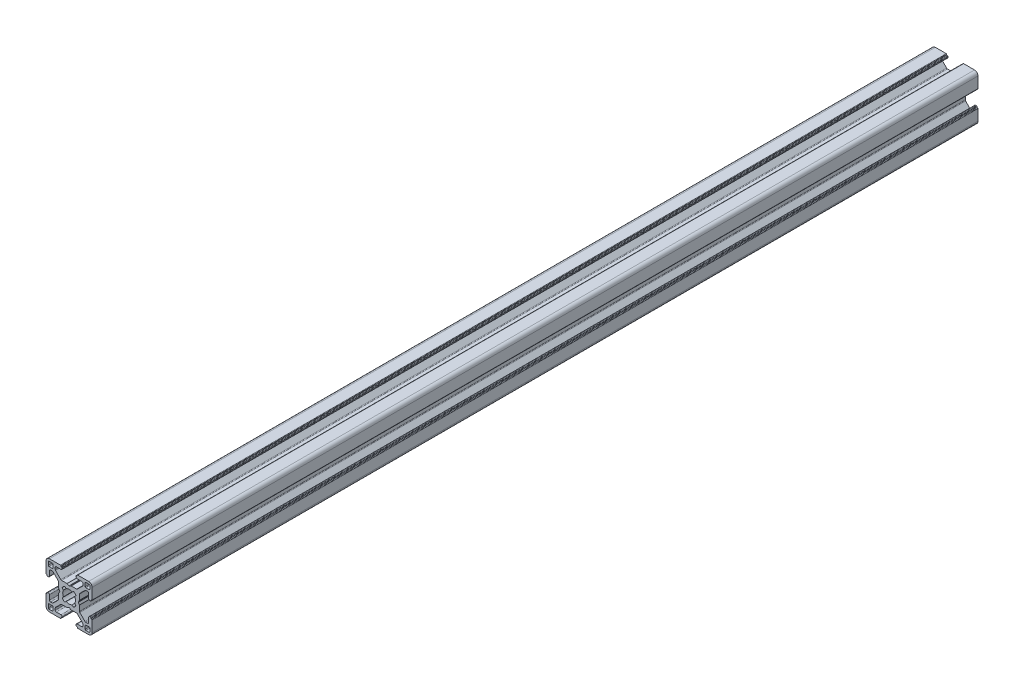
from build123d import *

# Parameters (mm, degrees)
ESTRUSIONE_ESTRUSIONE1_DEPTH = 384


with BuildPart() as part:
    # Schizzo1 → Estrusione-Estrusione1 (new body)
    with BuildSketch(Plane.XY.offset(100)):
        with BuildLine():
            Line((-9.299999732, 3), (-8.999999732, 3))
            ThreePointArc((-8.999999732, 3), (-8.646446341, 3.146446609), (-8.499999732, 3.5))
            Line((-8.499999732, 3.5), (-8.499999732, 5.499999605))
            ThreePointArc((-8.499999732, 5.499999605), (-8.353553123, 5.853552995), (-7.999999732, 5.999999605))
            Line((-7.999999732, 5.999999605), (-7.267766685, 5.999999605))
            ThreePointArc((-7.267766685, 5.999999605), (-7.076424969, 5.961939371), (-6.914213294, 5.853552995))
            Line((-6.914213294, 5.853552995), (-4.646446398, 3.585786099))
            ThreePointArc((-4.646446398, 3.585786099), (-4.538060023, 3.423574425), (-4.499999789, 3.232232708))
            Line((-4.499999789, 3.232232708), (-4.499999789, 0.953589302))
            ThreePointArc((-4.499999789, 0.953589302), (-4.493184953, 0.90182549), (-4.473204867, 0.853589297))
            Line((-4.473204867, 0.853589297), (-4.038119841, 0.099999969))
            ThreePointArc((-4.038119841, 0.099999969), (-4.011324929, 0), (-4.038119841, -0.099999969))
            Line((-4.038119841, -0.099999969), (-4.473204867, -0.853589297))
            ThreePointArc((-4.473204867, -0.853589297), (-4.493184953, -0.90182549), (-4.499999789, -0.953589302))
            Line((-4.499999789, -0.953589302), (-4.499999789, -3.232232708))
            ThreePointArc((-4.499999789, -3.232232708), (-4.538060023, -3.423574425), (-4.646446398, -3.585786099))
            Line((-4.646446398, -3.585786099), (-6.914213294, -5.853552995))
            ThreePointArc((-6.914213294, -5.853552995), (-7.076424969, -5.961939371), (-7.267766685, -5.999999605))
            Line((-7.267766685, -5.999999605), (-7.999999732, -5.999999605))
            ThreePointArc((-7.999999732, -5.999999605), (-8.353553123, -5.853552995), (-8.499999732, -5.499999605))
            Line((-8.499999732, -5.499999605), (-8.499999732, -3.5))
            ThreePointArc((-8.499999732, -3.5), (-8.646446341, -3.146446609), (-8.999999732, -3))
            Line((-8.999999732, -3), (-9.299999732, -3))
            ThreePointArc((-9.299999732, -3), (-9.441421088, -3.058578644), (-9.499999732, -3.2))
            Line((-9.499999732, -3.2), (-9.499999732, -3.349999605))
            ThreePointArc((-9.499999732, -3.349999605), (-9.558578376, -3.491420961), (-9.699999732, -3.549999605))
            Line((-9.699999732, -3.549999605), (-9.8, -3.549999605))
            ThreePointArc((-9.8, -3.549999605), (-9.941421356, -3.608578248), (-10, -3.749999605))
            Line((-10, -3.749999605), (-10, -8.5))
            ThreePointArc((-10, -8.5), (-9.560660172, -9.560660172), (-8.5, -10))
            Line((-8.5, -10), (-3.750000228, -10))
            ThreePointArc((-3.750000228, -10), (-3.608578871, -9.941421356), (-3.550000228, -9.8))
            Line((-3.550000228, -9.8), (-3.550000228, -9.7))
            ThreePointArc((-3.550000228, -9.7), (-3.491421584, -9.558578644), (-3.350000228, -9.5))
            Line((-3.350000228, -9.5), (-3.2, -9.5))
            ThreePointArc((-3.2, -9.5), (-3.058578644, -9.441421356), (-3, -9.3))
            Line((-3, -9.3), (-3, -8.999999673))
            ThreePointArc((-3, -8.999999673), (-3.146446609, -8.646446283), (-3.5, -8.499999673))
            Line((-3.5, -8.499999673), (-5.500000686, -8.499999673))
            ThreePointArc((-5.500000686, -8.499999673), (-5.853554077, -8.353553064), (-6.000000686, -7.999999673))
            Line((-6.000000686, -7.999999673), (-6.000000686, -7.267766626))
            ThreePointArc((-6.000000686, -7.267766626), (-5.961940448, -7.076424899), (-5.853554059, -6.914213219))
            Line((-5.853554059, -6.914213219), (-3.585787212, -4.646446592))
            ThreePointArc((-3.585787212, -4.646446592), (-3.423575544, -4.538060229), (-3.232233839, -4.5))
            Line((-3.232233839, -4.5), (-0.953590312, -4.5))
            ThreePointArc((-0.953590312, -4.5), (-0.901826505, -4.493185166), (-0.853590316, -4.473205083))
            Line((-0.853590316, -4.473205083), (-0.100000045, -4.038119562))
            ThreePointArc((-0.100000045, -4.038119562), (0, -4.011324632), (0.100000045, -4.038119562))
            Line((0.100000045, -4.038119562), (0.853590316, -4.473205083))
            ThreePointArc((0.853590316, -4.473205083), (0.901826505, -4.493185166), (0.953590312, -4.5))
            Line((0.953590312, -4.5), (3.23223292, -4.5))
            ThreePointArc((3.23223292, -4.5), (3.423574636, -4.538060234), (3.58578631, -4.646446609))
            Line((3.58578631, -4.646446609), (5.853554077, -6.914214376))
            ThreePointArc((5.853554077, -6.914214376), (5.961940452, -7.07642605), (6.000000686, -7.267767766))
            Line((6.000000686, -7.267767766), (6.000000686, -7.999999673))
            ThreePointArc((6.000000686, -7.999999673), (5.853554077, -8.353553064), (5.500000686, -8.499999673))
            Line((5.500000686, -8.499999673), (3.5, -8.499999673))
            ThreePointArc((3.5, -8.499999673), (3.146446609, -8.646446283), (3, -8.999999673))
            Line((3, -8.999999673), (3, -9.3))
            ThreePointArc((3, -9.3), (3.058578644, -9.441421356), (3.2, -9.5))
            Line((3.2, -9.5), (3.350000228, -9.5))
            ThreePointArc((3.350000228, -9.5), (3.491421584, -9.558578644), (3.550000228, -9.7))
            Line((3.550000228, -9.7), (3.550000228, -9.8))
            ThreePointArc((3.550000228, -9.8), (3.608578871, -9.941421356), (3.750000228, -10))
            Line((3.750000228, -10), (8.5, -10))
            ThreePointArc((8.5, -10), (9.560660172, -9.560660172), (10, -8.5))
            Line((10, -8.5), (10, -3.749999605))
            ThreePointArc((10, -3.749999605), (9.941421356, -3.608578248), (9.8, -3.549999605))
            Line((9.8, -3.549999605), (9.699999732, -3.549999605))
            ThreePointArc((9.699999732, -3.549999605), (9.558578376, -3.491420961), (9.499999732, -3.349999605))
            Line((9.499999732, -3.349999605), (9.499999732, -3.2))
            ThreePointArc((9.499999732, -3.2), (9.441421088, -3.058578644), (9.299999732, -3))
            Line((9.299999732, -3), (8.999999732, -3))
            ThreePointArc((8.999999732, -3), (8.646446341, -3.146446609), (8.499999732, -3.5))
            Line((8.499999732, -3.5), (8.499999732, -5.499999605))
            ThreePointArc((8.499999732, -5.499999605), (8.353553123, -5.853552995), (7.999999732, -5.999999605))
            Line((7.999999732, -5.999999605), (7.267766789, -5.999999605))
            ThreePointArc((7.267766789, -5.999999605), (7.076425084, -5.961939376), (6.914213416, -5.853553012))
            Line((6.914213416, -5.853553012), (4.646446415, -3.585786233))
            ThreePointArc((4.646446415, -3.585786233), (4.538060027, -3.423574553), (4.499999789, -3.232232825))
            Line((4.499999789, -3.232232825), (4.499999789, -0.953589302))
            ThreePointArc((4.499999789, -0.953589302), (4.493184953, -0.90182549), (4.473204867, -0.853589297))
            Line((4.473204867, -0.853589297), (4.038119841, -0.099999969))
            ThreePointArc((4.038119841, -0.099999969), (4.011324929, 0), (4.038119841, 0.099999969))
            Line((4.038119841, 0.099999969), (4.473204867, 0.853589297))
            ThreePointArc((4.473204867, 0.853589297), (4.493184953, 0.90182549), (4.499999789, 0.953589302))
            Line((4.499999789, 0.953589302), (4.499999789, 3.232232825))
            ThreePointArc((4.499999789, 3.232232825), (4.538060027, 3.423574553), (4.646446415, 3.585786233))
            Line((4.646446415, 3.585786233), (6.914213416, 5.853553012))
            ThreePointArc((6.914213416, 5.853553012), (7.076425084, 5.961939376), (7.267766789, 5.999999605))
            Line((7.267766789, 5.999999605), (7.999999732, 5.999999605))
            ThreePointArc((7.999999732, 5.999999605), (8.353553123, 5.853552995), (8.499999732, 5.499999605))
            Line((8.499999732, 5.499999605), (8.499999732, 3.5))
            ThreePointArc((8.499999732, 3.5), (8.646446341, 3.146446609), (8.999999732, 3))
            Line((8.999999732, 3), (9.299999732, 3))
            ThreePointArc((9.299999732, 3), (9.441421088, 3.058578644), (9.499999732, 3.2))
            Line((9.499999732, 3.2), (9.499999732, 3.349999605))
            ThreePointArc((9.499999732, 3.349999605), (9.558578376, 3.491420961), (9.699999732, 3.549999605))
            Line((9.699999732, 3.549999605), (9.8, 3.549999605))
            ThreePointArc((9.8, 3.549999605), (9.941421356, 3.608578248), (10, 3.749999605))
            Line((10, 3.749999605), (10, 8.5))
            ThreePointArc((10, 8.5), (9.560660172, 9.560660172), (8.5, 10))
            Line((8.5, 10), (3.750000228, 10))
            ThreePointArc((3.750000228, 10), (3.608578871, 9.941421356), (3.550000228, 9.8))
            Line((3.550000228, 9.8), (3.550000228, 9.7))
            ThreePointArc((3.550000228, 9.7), (3.491421584, 9.558578644), (3.350000228, 9.5))
            Line((3.350000228, 9.5), (3.2, 9.5))
            ThreePointArc((3.2, 9.5), (3.058578644, 9.441421356), (3, 9.3))
            Line((3, 9.3), (3, 8.999999673))
            ThreePointArc((3, 8.999999673), (3.146446609, 8.646446283), (3.5, 8.499999673))
            Line((3.5, 8.499999673), (5.500000686, 8.499999673))
            ThreePointArc((5.500000686, 8.499999673), (5.853554077, 8.353553064), (6.000000686, 7.999999673))
            Line((6.000000686, 7.999999673), (6.000000686, 7.267767766))
            ThreePointArc((6.000000686, 7.267767766), (5.961940452, 7.07642605), (5.853554077, 6.914214376))
            Line((5.853554077, 6.914214376), (3.58578631, 4.646446609))
            ThreePointArc((3.58578631, 4.646446609), (3.423574636, 4.538060234), (3.23223292, 4.5))
            Line((3.23223292, 4.5), (0.953590312, 4.5))
            ThreePointArc((0.953590312, 4.5), (0.901826505, 4.493185166), (0.853590316, 4.473205083))
            Line((0.853590316, 4.473205083), (0.100000045, 4.038119562))
            ThreePointArc((0.100000045, 4.038119562), (0, 4.011324632), (-0.100000045, 4.038119562))
            Line((-0.100000045, 4.038119562), (-0.853590316, 4.473205083))
            ThreePointArc((-0.853590316, 4.473205083), (-0.901826505, 4.493185166), (-0.953590312, 4.5))
            Line((-0.953590312, 4.5), (-3.232233839, 4.5))
            ThreePointArc((-3.232233839, 4.5), (-3.423575544, 4.538060229), (-3.585787212, 4.646446592))
            Line((-3.585787212, 4.646446592), (-5.853554059, 6.914213219))
            ThreePointArc((-5.853554059, 6.914213219), (-5.961940448, 7.076424899), (-6.000000686, 7.267766626))
            Line((-6.000000686, 7.267766626), (-6.000000686, 7.999999673))
            ThreePointArc((-6.000000686, 7.999999673), (-5.853554077, 8.353553064), (-5.500000686, 8.499999673))
            Line((-5.500000686, 8.499999673), (-3.5, 8.499999673))
            ThreePointArc((-3.5, 8.499999673), (-3.146446609, 8.646446283), (-3, 8.999999673))
            Line((-3, 8.999999673), (-3, 9.3))
            ThreePointArc((-3, 9.3), (-3.058578644, 9.441421356), (-3.2, 9.5))
            Line((-3.2, 9.5), (-3.350000228, 9.5))
            ThreePointArc((-3.350000228, 9.5), (-3.491421584, 9.558578644), (-3.550000228, 9.7))
            Line((-3.550000228, 9.7), (-3.550000228, 9.8))
            ThreePointArc((-3.550000228, 9.8), (-3.608578871, 9.941421356), (-3.750000228, 10))
            Line((-3.750000228, 10), (-8.5, 10))
            ThreePointArc((-8.5, 10), (-9.560660172, 9.560660172), (-10, 8.5))
            Line((-10, 8.5), (-10, 3.749999605))
            ThreePointArc((-10, 3.749999605), (-9.941421356, 3.608578248), (-9.8, 3.549999605))
            Line((-9.8, 3.549999605), (-9.699999732, 3.549999605))
            ThreePointArc((-9.699999732, 3.549999605), (-9.558578376, 3.491420961), (-9.499999732, 3.349999605))
            Line((-9.499999732, 3.349999605), (-9.499999732, 3.2))
            ThreePointArc((-9.499999732, 3.2), (-9.441421088, 3.058578644), (-9.299999732, 3))
        make_face()
        with BuildLine():
            Line((-1.91389502, 2.989640962), (-1.258185436, 2.445295362))
            ThreePointArc((-1.258185436, 2.445295362), (0, 2.75), (1.258185436, 2.445295362))
            Line((1.258185436, 2.445295362), (1.91389502, 2.989640962))
            ThreePointArc((1.91389502, 2.989640962), (2.511737261, 2.508410485), (2.992174953, 1.909930962))
            Line((2.992174953, 1.909930962), (2.445295423, 1.258185317))
            ThreePointArc((2.445295423, 1.258185317), (2.75, 0), (2.445295423, -1.258185317))
            Line((2.445295423, -1.258185317), (2.992174953, -1.909930962))
            ThreePointArc((2.992174953, -1.909930962), (2.511737261, -2.508410485), (1.91389502, -2.989640962))
            Line((1.91389502, -2.989640962), (1.258185436, -2.445295362))
            ThreePointArc((1.258185436, -2.445295362), (0, -2.75), (-1.258185436, -2.445295362))
            Line((-1.258185436, -2.445295362), (-1.91389502, -2.989640962))
            ThreePointArc((-1.91389502, -2.989640962), (-2.511737261, -2.508410485), (-2.992174953, -1.909930962))
            Line((-2.992174953, -1.909930962), (-2.445295423, -1.258185317))
            ThreePointArc((-2.445295423, -1.258185317), (-2.75, 0), (-2.445295423, 1.258185317))
            Line((-2.445295423, 1.258185317), (-2.992174953, 1.909930962))
            ThreePointArc((-2.992174953, 1.909930962), (-2.511737261, 2.508410485), (-1.91389502, 2.989640962))
        make_face(mode=Mode.SUBTRACT)
        with BuildLine():
            Line((8.699999314, 7.000000686), (7.3, 7.000000686))
            ThreePointArc((7.3, 7.000000686), (7.087867966, 7.087868652), (7, 7.300000686))
            Line((7, 7.300000686), (7, 8.7))
            ThreePointArc((7, 8.7), (7.087867966, 8.912132034), (7.3, 9))
            Line((7.3, 9), (8.699999314, 9))
            ThreePointArc((8.699999314, 9), (8.912131348, 8.912132034), (8.999999314, 8.7))
            Line((8.999999314, 8.7), (8.999999314, 7.300000686))
            ThreePointArc((8.999999314, 7.300000686), (8.912131348, 7.087868652), (8.699999314, 7.000000686))
        make_face(mode=Mode.SUBTRACT)
        with BuildLine():
            Line((-7.300000686, 7.000000686), (-8.7, 7.000000686))
            ThreePointArc((-8.7, 7.000000686), (-8.912132034, 7.087868652), (-9, 7.300000686))
            Line((-9, 7.300000686), (-9, 8.7))
            ThreePointArc((-9, 8.7), (-8.912132034, 8.912132034), (-8.7, 9))
            Line((-8.7, 9), (-7.300000686, 9))
            ThreePointArc((-7.300000686, 9), (-7.087868652, 8.912132034), (-7.000000686, 8.7))
            Line((-7.000000686, 8.7), (-7.000000686, 7.300000686))
            ThreePointArc((-7.000000686, 7.300000686), (-7.087868652, 7.087868652), (-7.300000686, 7.000000686))
        make_face(mode=Mode.SUBTRACT)
        with BuildLine():
            Line((8.699999314, -8.999999314), (7.3, -8.999999314))
            ThreePointArc((7.3, -8.999999314), (7.087867966, -8.912131348), (7, -8.699999314))
            Line((7, -8.699999314), (7, -7.3))
            ThreePointArc((7, -7.3), (7.087867966, -7.087867966), (7.3, -7))
            Line((7.3, -7), (8.699999314, -7))
            ThreePointArc((8.699999314, -7), (8.912131348, -7.087867966), (8.999999314, -7.3))
            Line((8.999999314, -7.3), (8.999999314, -8.699999314))
            ThreePointArc((8.999999314, -8.699999314), (8.912131348, -8.912131348), (8.699999314, -8.999999314))
        make_face(mode=Mode.SUBTRACT)
        with BuildLine():
            Line((-7.300000686, -8.999999314), (-8.7, -8.999999314))
            ThreePointArc((-8.7, -8.999999314), (-8.912132034, -8.912131348), (-9, -8.699999314))
            Line((-9, -8.699999314), (-9, -7.3))
            ThreePointArc((-9, -7.3), (-8.912132034, -7.087867966), (-8.7, -7))
            Line((-8.7, -7), (-7.300000686, -7))
            ThreePointArc((-7.300000686, -7), (-7.087868652, -7.087867966), (-7.000000686, -7.3))
            Line((-7.000000686, -7.3), (-7.000000686, -8.699999314))
            ThreePointArc((-7.000000686, -8.699999314), (-7.087868652, -8.912131348), (-7.300000686, -8.999999314))
        make_face(mode=Mode.SUBTRACT)
    extrude(amount=-ESTRUSIONE_ESTRUSIONE1_DEPTH)


solid = part.part
